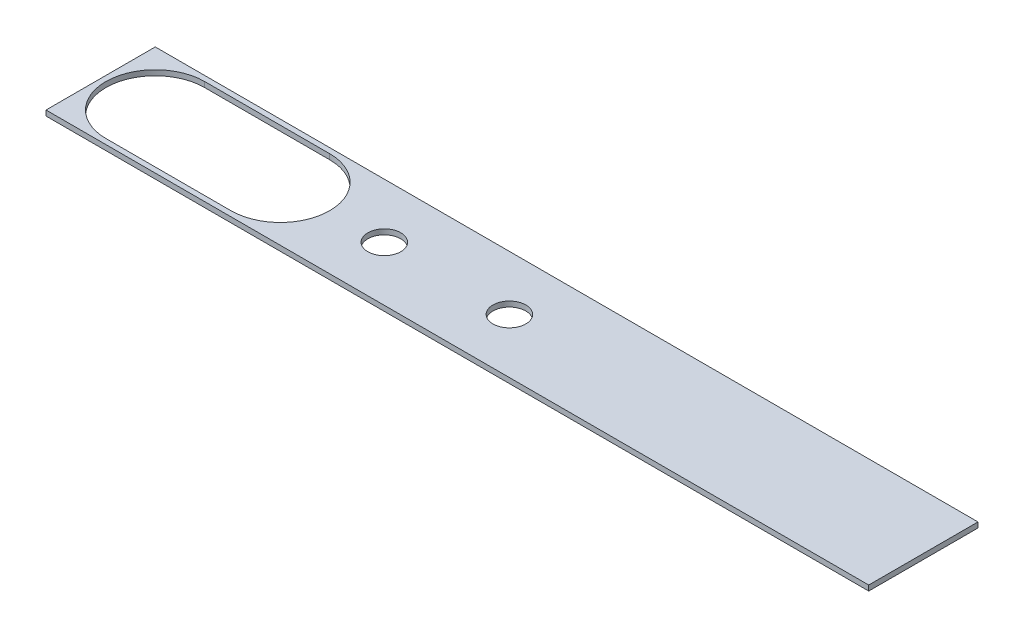
from build123d import *

# Parameters (mm, degrees)
SKETCH1_W           = 250
SKETCH1_H           = 33.2
BOSS_EXTRUDE1_DEPTH = 1.6
SKETCH2_R           = 5
CUT_EXTRUDE1_DEPTH  = 127.107573127


with BuildPart() as part:
    # Sketch1 → Boss-Extrude1 (new body)
    with BuildSketch(Plane(origin=(0, 0, 0), x_dir=(1, 0, 0), z_dir=(0, 1, 0))):
        Rectangle(SKETCH1_W, SKETCH1_H)
    extrude(amount=-BOSS_EXTRUDE1_DEPTH)

    # Sketch2 → Cut-Extrude1 (cut, through all)
    with BuildSketch(Plane(origin=(0, 0, 0), x_dir=(1, 0, 0), z_dir=(0, 1, 0))):
        with Locations(Location((-38.8, 0, 0), (0, 0, 270))):
            Circle(SKETCH2_R)
        with Locations(Location((-0.8, 0, 0), (0, 0, 270))):
            Circle(SKETCH2_R)
        with BuildLine():
            Line((-108.4, 15), (-70.4, 15))
            ThreePointArc((-70.4, 15), (-55.4, 0), (-70.4, -15))
            Line((-70.4, -15), (-108.4, -15))
            ThreePointArc((-108.4, -15), (-123.4, 0), (-108.4, 15))
        make_face()
    extrude(amount=-CUT_EXTRUDE1_DEPTH, mode=Mode.SUBTRACT)


solid = part.part
